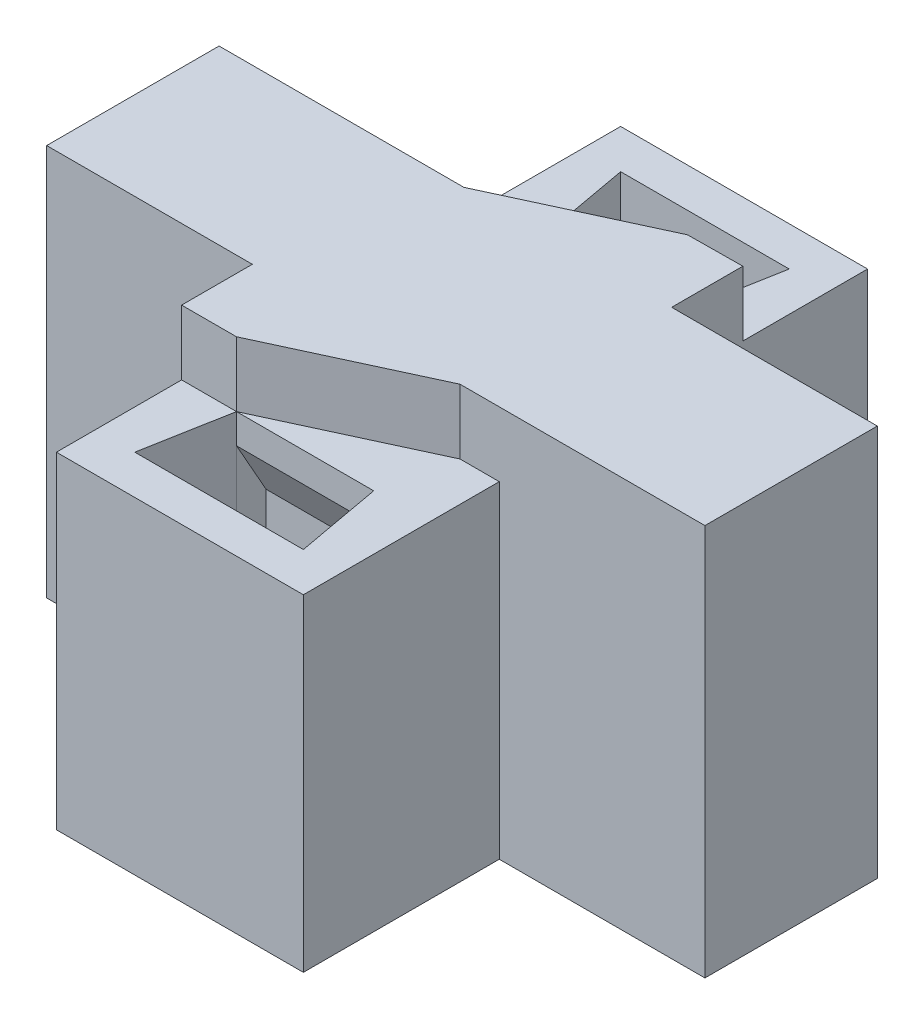
from build123d import *

# Parameters (mm, degrees)
SKETCH1_W            = 106.68
SKETCH1_H            = 27.94
BOSS_EXTRUDE1_DEPTH  = 63.5
CUT_EXTRUDE2_DEPTH   = 96.52
SKETCH38_W           = 40.02
SKETCH38_H           = 63.5
BOSS_EXTRUDE25_DEPTH = 6.66
SKETCH40_W           = 6.35
SKETCH40_H           = 63.5
BOSS_EXTRUDE26_DEPTH = 18.74
SKETCH41_W           = 6.35
SKETCH41_H           = 63.5
BOSS_EXTRUDE27_DEPTH = 18.74
SKETCH43_W           = 27.32
SKETCH43_H           = 17.89
BOSS_EXTRUDE28_DEPTH = 18.74
CUT_EXTRUDE13_DEPTH  = 10.5
SKETCH46_W           = 27.32
SKETCH46_H           = 4.8
BOSS_EXTRUDE29_DEPTH = 4.8
BOSS_EXTRUDE30_DEPTH = 33.36
BOSS_EXTRUDE31_DEPTH = 35.11
BOSS_EXTRUDE32_DEPTH = 35.11
SKETCH52_W           = 40.02
SKETCH52_H           = 53
BOSS_EXTRUDE33_DEPTH = 6.35
SKETCH55_W           = 2.54
SKETCH55_H           = 4.8
BOSS_EXTRUDE37_DEPTH = 35.11
SKETCH56_W           = 2.54
SKETCH56_H           = 4.8
BOSS_EXTRUDE38_DEPTH = 35.11
BOSS_EXTRUDE35_DEPTH = 10.5
BOSS_EXTRUDE36_DEPTH = 10.5


with BuildPart() as part:
    # Sketch1 → Boss-Extrude1 (new body)
    with BuildSketch(Plane(origin=(0, 0, 0), x_dir=(1, 0, 0), z_dir=(0, 1, 0))):
        with Locations((53.34, -13.97)):
            Rectangle(SKETCH1_W, SKETCH1_H)
    extrude(amount=BOSS_EXTRUDE1_DEPTH)

    # Sketch2 → Cut-Extrude2 (cut)
    with BuildSketch(Plane.ZY):
        with BuildLine():
            Line((6.35, 50.8), (6.35, 6.35))
            Line((6.35, 6.35), (21.59, 6.35))
            Line((21.59, 6.35), (21.59, 50.8))
            add(Edge.make_bspline(
                [(6.35, 50.8), (13.97, 66.04), (21.59, 50.8)],
                knots=[0, 0, 0, 1, 1, 1], degree=2))
        make_face()
    extrude(amount=-CUT_EXTRUDE2_DEPTH, mode=Mode.SUBTRACT)

    # Sketch38 → Boss-Extrude25 (add)
    with BuildSketch(Plane(origin=(0, 0, 0), x_dir=(-1, 0, 0), z_dir=(0, 0, -1))):
        with Locations((-53.34, 31.75)):
            Rectangle(SKETCH38_W, SKETCH38_H)
    boss_extrude25 = extrude(amount=BOSS_EXTRUDE25_DEPTH)

    # Sketch40 → Boss-Extrude26 (add)
    with BuildSketch(Plane(origin=(0, 0, -6.66), x_dir=(-1, 0, 0), z_dir=(0, 0, -1))):
        with Locations((-70.175, 31.75)):
            Rectangle(SKETCH40_W, SKETCH40_H)
    boss_extrude26 = extrude(amount=BOSS_EXTRUDE26_DEPTH)

    # Sketch41 → Boss-Extrude27 (add)
    with BuildSketch(Plane(origin=(0, 0, -6.66), x_dir=(-1, 0, 0), z_dir=(0, 0, -1))):
        with Locations((-36.505, 31.75)):
            Rectangle(SKETCH41_W, SKETCH41_H)
    boss_extrude27 = extrude(amount=BOSS_EXTRUDE27_DEPTH)

    # Sketch43 → Boss-Extrude28 (add)
    with BuildSketch(Plane(origin=(0, 0, -6.66), x_dir=(-1, 0, 0), z_dir=(0, 0, -1))):
        with Locations((-53.34, 8.945)):
            Rectangle(SKETCH43_W, SKETCH43_H)
    boss_extrude28 = extrude(amount=BOSS_EXTRUDE28_DEPTH)

    # Sketch44 → Cut-Extrude13 (cut)
    with BuildSketch(Plane(origin=(0, 63.5, 0), x_dir=(1, 0, 0), z_dir=(0, 1, 0))):
        Polygon((73.35, 0), (33.33, 0), (33.33, 25.4), (39.68, 25.4), (39.68, 6.66), (67, 6.66), (67, 25.4), (73.35, 25.4), align=None)
    cut_extrude13 = extrude(amount=-CUT_EXTRUDE13_DEPTH, mode=Mode.SUBTRACT)

    # Sketch46 → Boss-Extrude29 (add)
    with BuildSketch(Plane(origin=(0, 0, -6.66), x_dir=(-1, 0, 0), z_dir=(0, 0, -1))):
        with Locations((-53.34, 50.6)):
            Rectangle(SKETCH46_W, SKETCH46_H)
    boss_extrude29 = extrude(amount=BOSS_EXTRUDE29_DEPTH)

    # Sketch48 → Boss-Extrude30 (add)
    with BuildSketch(Plane(origin=(39.68, 0, 0), x_dir=(0, 0, -1), z_dir=(1, 0, 0))):
        Polygon((11.46, 48.2), (6.66, 39.7), (6.66, 48.2), align=None)
    boss_extrude30 = extrude(amount=BOSS_EXTRUDE30_DEPTH)

    # Sketch50 → Boss-Extrude31 (add)
    with BuildSketch(Plane(origin=(0, 53, 0), x_dir=(1, 0, 0), z_dir=(0, 1, 0))):
        Polygon((64.46, 11.46), (67, 25.4), (67, 11.46), align=None)
    boss_extrude31 = extrude(amount=-BOSS_EXTRUDE31_DEPTH)

    # Sketch51 → Boss-Extrude32 (add)
    with BuildSketch(Plane(origin=(0, 53, 0), x_dir=(1, 0, 0), z_dir=(0, 1, 0))):
        Polygon((42.22, 11.46), (39.68, 11.46), (39.68, 25.4), align=None)
    boss_extrude32 = extrude(amount=-BOSS_EXTRUDE32_DEPTH)

    # Sketch52 → Boss-Extrude33 (add)
    with BuildSketch(Plane(origin=(0, 0, -25.4), x_dir=(-1, 0, 0), z_dir=(0, 0, -1))):
        with Locations((-53.34, 26.5)):
            Rectangle(SKETCH52_W, SKETCH52_H)
    boss_extrude33 = extrude(amount=BOSS_EXTRUDE33_DEPTH)

    # Sketch55 → Boss-Extrude37 (add)
    with BuildSketch(Plane(origin=(0, 17.89, 0), x_dir=(1, 0, 0), z_dir=(0, 1, 0))):
        with Locations((65.73, 9.06)):
            Rectangle(SKETCH55_W, SKETCH55_H)
    boss_extrude37 = extrude(amount=BOSS_EXTRUDE37_DEPTH)

    # Sketch56 → Boss-Extrude38 (add)
    with BuildSketch(Plane(origin=(0, 17.89, 0), x_dir=(1, 0, 0), z_dir=(0, 1, 0))):
        with Locations((40.95, 9.06)):
            Rectangle(SKETCH56_W, SKETCH56_H)
    boss_extrude38 = extrude(amount=BOSS_EXTRUDE38_DEPTH)

    # Mirror5: Boss-Extrude25, Boss-Extrude26, Boss-Extrude27, Boss-Extrude28, Cut-Extrude13, Boss-Extrude29, Boss-Extrude30, Boss-Extrude31, Boss-Extrude32, Boss-Extrude33, Boss-Extrude37, Boss-Extrude38 across plane
    add(boss_extrude25.mirror(Plane(origin=(0, 0, 13.97), x_dir=(1, 0, 0), z_dir=(0, 0, -1))))
    add(boss_extrude26.mirror(Plane(origin=(0, 0, 13.97), x_dir=(1, 0, 0), z_dir=(0, 0, -1))))
    add(boss_extrude27.mirror(Plane(origin=(0, 0, 13.97), x_dir=(1, 0, 0), z_dir=(0, 0, -1))))
    add(boss_extrude28.mirror(Plane(origin=(0, 0, 13.97), x_dir=(1, 0, 0), z_dir=(0, 0, -1))))
    add(cut_extrude13.mirror(Plane(origin=(0, 0, 13.97), x_dir=(1, 0, 0), z_dir=(0, 0, -1))), mode=Mode.SUBTRACT)
    add(boss_extrude29.mirror(Plane(origin=(0, 0, 13.97), x_dir=(1, 0, 0), z_dir=(0, 0, -1))))
    add(boss_extrude30.mirror(Plane(origin=(0, 0, 13.97), x_dir=(1, 0, 0), z_dir=(0, 0, -1))))
    add(boss_extrude31.mirror(Plane(origin=(0, 0, 13.97), x_dir=(1, 0, 0), z_dir=(0, 0, -1))))
    add(boss_extrude32.mirror(Plane(origin=(0, 0, 13.97), x_dir=(1, 0, 0), z_dir=(0, 0, -1))))
    add(boss_extrude33.mirror(Plane(origin=(0, 0, 13.97), x_dir=(1, 0, 0), z_dir=(0, 0, -1))))
    add(boss_extrude37.mirror(Plane(origin=(0, 0, 13.97), x_dir=(1, 0, 0), z_dir=(0, 0, -1))))
    add(boss_extrude38.mirror(Plane(origin=(0, 0, 13.97), x_dir=(1, 0, 0), z_dir=(0, 0, -1))))

    # Sketch53 → Boss-Extrude35 (add)
    with BuildSketch(Plane(origin=(0, 53, 0), x_dir=(1, 0, 0), z_dir=(0, 1, 0))):
        Polygon((64.46, 11.46), (39.68, 0), (73.35, 0), (73.35, 11.539525475), align=None)
    extrude(amount=BOSS_EXTRUDE35_DEPTH)

    # Sketch54 → Boss-Extrude36 (add)
    with BuildSketch(Plane(origin=(0, 53, 0), x_dir=(1, 0, 0), z_dir=(0, 1, 0))):
        Polygon((42.22, -39.4), (33.33, -39.4), (33.33, -27.94), (67, -27.94), align=None)
    extrude(amount=BOSS_EXTRUDE36_DEPTH)


solid = part.part
